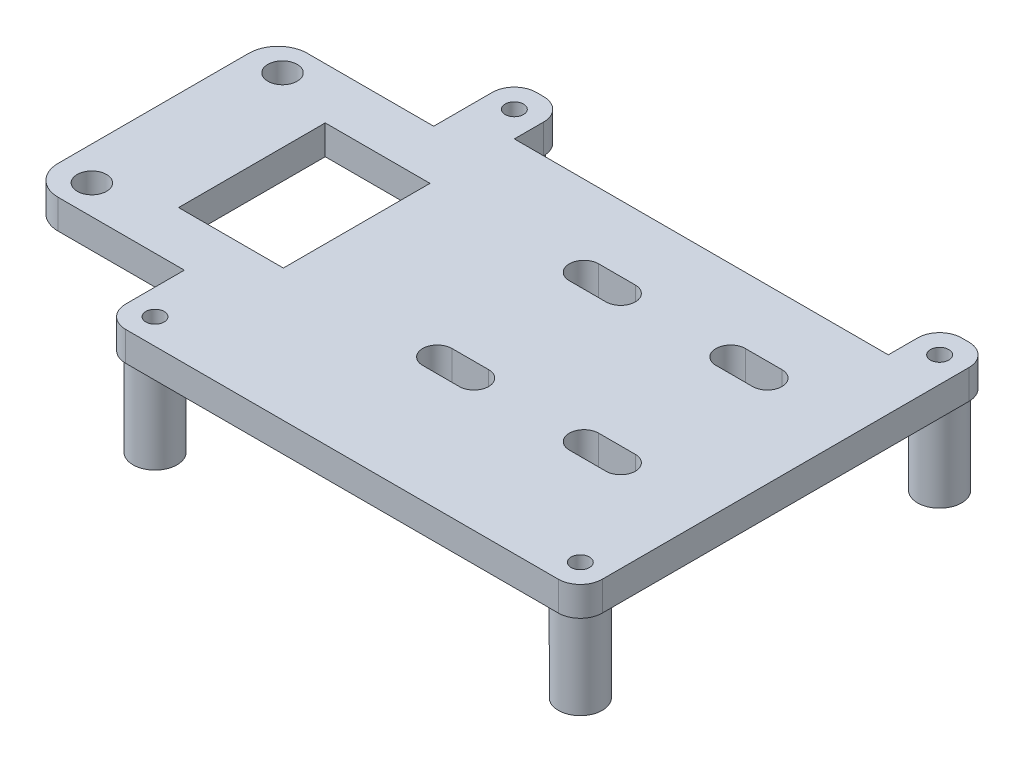
from build123d import *
from build123d.topology import SkipClean

# Parameters (mm, degrees)
SKETCH1_R           = 1.25
SKETCH1_R_2         = 2
BOSS_EXTRUDE1_DEPTH = 4
FILLET1_R           = 3
CUT_EXTRUDE1_DEPTH  = 4
BOSS_EXTRUDE2_START = 12
SKETCH3_R           = 3
SKETCH3_R_2         = 1.25
BOSS_EXTRUDE2_DEPTH = 12


with BuildPart() as part:
    # Sketch1 → Boss-Extrude1 (new body)
    with BuildSketch(Plane(origin=(0, 0, 0), x_dir=(1, 0, 0), z_dir=(0, 1, 0))):
        with BuildLine():
            Line((-29.136771411, 21.21972047), (-29.136771411, 32.21972047))
            Line((-29.136771411, 32.21972047), (-22.136771411, 32.21972047))
            Line((-22.136771411, 32.21972047), (-22.136771411, 25.21972047))
            Line((-22.136771411, 25.21972047), (28.863228589, 25.21972047))
            Line((28.863228589, 25.21972047), (28.863228589, 32.21972047))
            Line((28.863228589, 32.21972047), (35.863228589, 32.21972047))
            Line((35.863228589, 32.21972047), (35.863228589, -23.78027953))
            Line((35.863228589, -23.78027953), (-29.136771411, -23.78027953))
            Line((-29.136771411, -23.78027953), (-29.136771411, -12.78027953))
            Line((-29.136771411, -12.78027953), (-46.358384932, -12.78027953))
            ThreePointArc((-46.358384932, -12.78027953), (-49.186812057, -11.608706655), (-50.358384932, -8.78027953))
            Line((-50.358384932, -8.78027953), (-50.358384932, 17.21972047))
            ThreePointArc((-50.358384932, 17.21972047), (-49.186812057, 20.048147594), (-46.358384932, 21.21972047))
            Line((-46.358384932, 21.21972047), (-29.136771411, 21.21972047))
        make_face()
        with Locations(Location((32.363228589, 28.71972047, 0), (0, 0, 270))):
            Circle(SKETCH1_R, mode=Mode.SUBTRACT)
        with Locations(Location((-25.636771411, 28.71972047, 0), (0, 0, 270))):
            Circle(SKETCH1_R, mode=Mode.SUBTRACT)
        with Locations(Location((32.363228589, -20.28027953, 0), (0, 0, 270))):
            Circle(SKETCH1_R, mode=Mode.SUBTRACT)
        with Locations(Location((-25.636771411, -20.28027953, 0), (0, 0, 270))):
            Circle(SKETCH1_R, mode=Mode.SUBTRACT)
        with Locations(Location((-45.749381244, 17.21972047, 0), (0, 0, 270))):
            Circle(SKETCH1_R_2, mode=Mode.SUBTRACT)
        with Locations(Location((-45.749381244, -8.78027953, 0), (0, 0, 270))):
            Circle(SKETCH1_R_2, mode=Mode.SUBTRACT)
        Polygon((-29.136771411, 14.21972047), (-22.636771411, 14.21972047), (-22.636771411, -5.78027953), (-29.136771411, -5.78027953), (-36.923074247, -5.78027953), (-36.923074247, 14.21972047), align=None, mode=Mode.SUBTRACT)
    extrude(amount=BOSS_EXTRUDE1_DEPTH)

    # Fillet1
    fillet1_edges = [part.edges().sort_by_distance(p)[0] for p in [
        (-22.136771411, 2, -32.21972047),
        (28.863228589, 2, -32.21972047),
        (35.863228589, 2, -32.21972047),
        (35.863228589, 2, 23.78027953),
        (-29.136771411, 2, 23.78027953),
        (-29.136771411, 2, -32.21972047),
    ]]
    fillet(fillet1_edges, radius=FILLET1_R)

    # Sketch2 → Cut-Extrude1 (cut)
    with BuildSketch(Plane(origin=(0, 4, 0), x_dir=(1, 0, 0), z_dir=(0, 1, 0))):
        with BuildLine():
            Line((-1.636771411, 16.21972047), (3.363228589, 16.21972047))
            ThreePointArc((3.363228589, 16.21972047), (5.363228589, 14.21972047), (3.363228589, 12.21972047))
            Line((3.363228589, 12.21972047), (-1.636771411, 12.21972047))
            ThreePointArc((-1.636771411, 12.21972047), (-3.636771411, 14.21972047), (-1.636771411, 16.21972047))
        make_face()
        with BuildLine():
            Line((18.363228589, 16.21972047), (23.363228589, 16.21972047))
            ThreePointArc((23.363228589, 16.21972047), (25.363228589, 14.21972047), (23.363228589, 12.21972047))
            Line((23.363228589, 12.21972047), (18.363228589, 12.21972047))
            ThreePointArc((18.363228589, 12.21972047), (16.363228589, 14.21972047), (18.363228589, 16.21972047))
        make_face()
        with BuildLine():
            Line((23.363228589, -3.78027953), (18.363228589, -3.78027953))
            ThreePointArc((18.363228589, -3.78027953), (16.363228589, -5.78027953), (18.363228589, -7.78027953))
            Line((18.363228589, -7.78027953), (23.363228589, -7.78027953))
            ThreePointArc((23.363228589, -7.78027953), (25.363228589, -5.78027953), (23.363228589, -3.78027953))
        make_face()
        with BuildLine():
            Line((-1.636771411, -3.78027953), (3.363228589, -3.78027953))
            ThreePointArc((3.363228589, -3.78027953), (5.363228589, -5.78027953), (3.363228589, -7.78027953))
            Line((3.363228589, -7.78027953), (-1.636771411, -7.78027953))
            ThreePointArc((-1.636771411, -7.78027953), (-3.636771411, -5.78027953), (-1.636771411, -3.78027953))
        make_face()
    extrude(amount=-CUT_EXTRUDE1_DEPTH, mode=Mode.SUBTRACT)

    # Sketch3 → Boss-Extrude2 (add)
    # profile 1 of 4: a face of its own
    with SkipClean():  # the faces are left unmerged after this step: merging them gives an invalid solid
        with BuildSketch(Plane.XZ.offset(BOSS_EXTRUDE2_START)):
            with Locations(Location((-25.636771411, 20.28027953, 0), (0, 0, 90))):
                Circle(SKETCH3_R)
            with Locations(Location((-25.636771411, 20.28027953, 0), (0, 0, 270))):
                Circle(SKETCH3_R_2, mode=Mode.SUBTRACT)
        # profile 2 of 4: a face of its own
        with BuildSketch(Plane.XZ.offset(BOSS_EXTRUDE2_START)):
            with Locations(Location((-25.636771411, -28.71972047, 0), (0, 0, 90))):
                Circle(SKETCH3_R)
            with Locations(Location((-25.636771411, -28.71972047, 0), (0, 0, 270))):
                Circle(SKETCH3_R_2, mode=Mode.SUBTRACT)
        # profile 3 of 4: a face of its own
        with BuildSketch(Plane.XZ.offset(BOSS_EXTRUDE2_START)):
            with Locations(Location((32.363228589, -28.71972047, 0), (0, 0, 90))):
                Circle(SKETCH3_R)
            with Locations(Location((32.363228589, -28.71972047, 0), (0, 0, 270))):
                Circle(SKETCH3_R_2, mode=Mode.SUBTRACT)
        # profile 4 of 4: a face of its own
        with BuildSketch(Plane.XZ.offset(BOSS_EXTRUDE2_START)):
            with Locations(Location((32.363228589, 20.28027953, 0), (0, 0, 90))):
                Circle(SKETCH3_R)
            with Locations(Location((32.363228589, 20.28027953, 0), (0, 0, 270))):
                Circle(SKETCH3_R_2, mode=Mode.SUBTRACT)
        extrude(amount=-BOSS_EXTRUDE2_DEPTH)


solid = part.part
